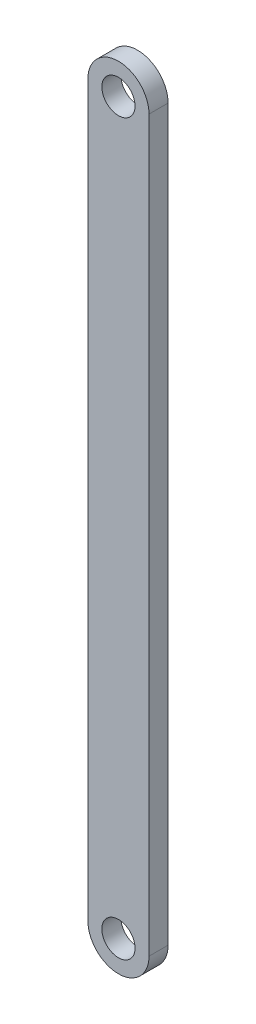
from build123d import *

# Parameters (mm, degrees)
SKETCH1_R           = 4.35
BOSS_EXTRUDE1_DEPTH = 5


with BuildPart() as part:
    # Sketch1 → Boss-Extrude1 (new body)
    with BuildSketch(Plane.XY):
        with BuildLine():
            Line((-8, 0), (-8, 191))
            ThreePointArc((-8, 191), (0, 199), (8, 191))
            Line((8, 191), (8, 0))
            ThreePointArc((8, 0), (0, -8), (-8, 0))
        make_face()
        with Locations((0, 191)):
            Circle(SKETCH1_R, mode=Mode.SUBTRACT)
        Circle(SKETCH1_R, mode=Mode.SUBTRACT)
    extrude(amount=BOSS_EXTRUDE1_DEPTH)


solid = part.part
